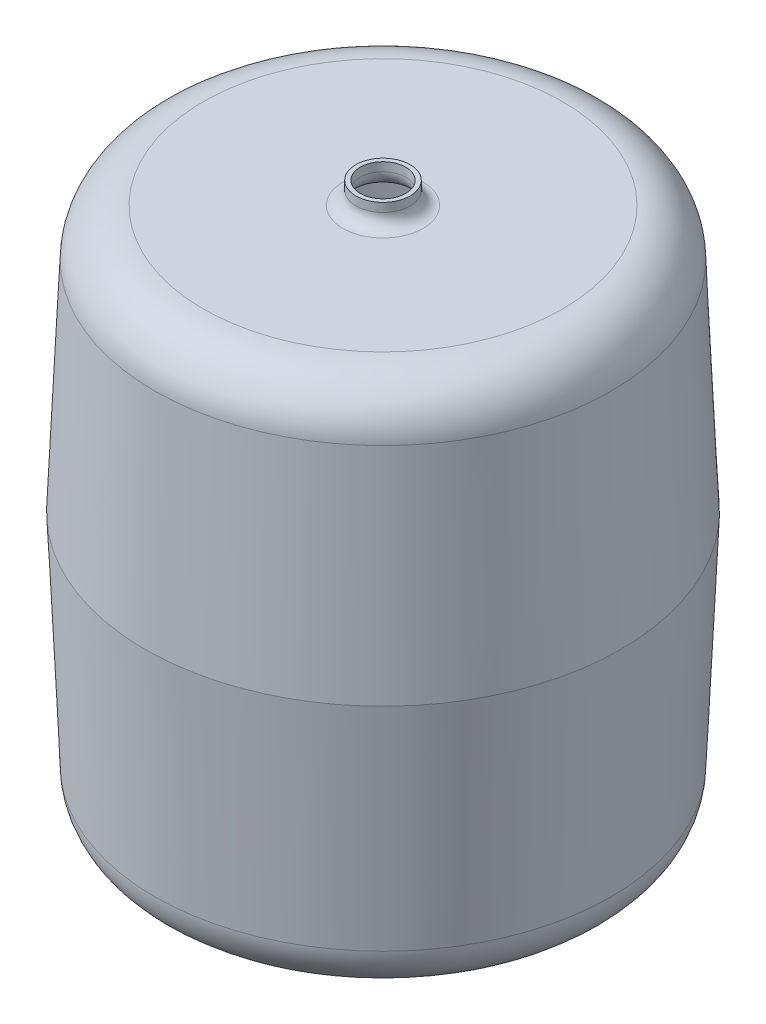
from build123d import *


with BuildPart() as part:
    # Sketch1 → Revolve1 (revolve)
    with BuildSketch(Plane.XY):
        with BuildLine():
            Line((0, 0), (165.671871599, 0))
            ThreePointArc((165.671871599, 0), (196.789959109, 12.493621707), (210.62904157, 43.037127569))
            Line((210.62904157, 43.037127569), (219.446931013, 245))
            Line((219.446931013, 245), (210.62904157, 446.962872431))
            ThreePointArc((210.62904157, 446.962872431), (196.789959109, 477.506378293), (165.671871599, 490))
            Line((165.671871599, 490), (37, 490))
            ThreePointArc((37, 490), (28.514718626, 493.514718626), (25, 502))
            Line((25, 502), (25, 510))
            Line((25, 510), (21, 510))
            Line((21, 510), (21, 502))
            ThreePointArc((21, 502), (25.686291501, 490.686291501), (37, 486))
            Line((37, 486), (165.671871599, 486))
            ThreePointArc((165.671871599, 486), (194.023906886, 474.616922444), (206.632848683, 446.788394882))
            Line((206.632848683, 446.788394882), (215.443120272, 245))
            Line((215.443120272, 245), (206.632848683, 43.211605118))
            ThreePointArc((206.632848683, 43.211605118), (194.023906886, 15.383077556), (165.671871599, 4))
            Line((165.671871599, 4), (0, 4))
            Line((0, 4), (0, 0))
        make_face()
    revolve(axis=Axis((0, -5395.196891383, 0), (0, 1, 0)))


solid = part.part
